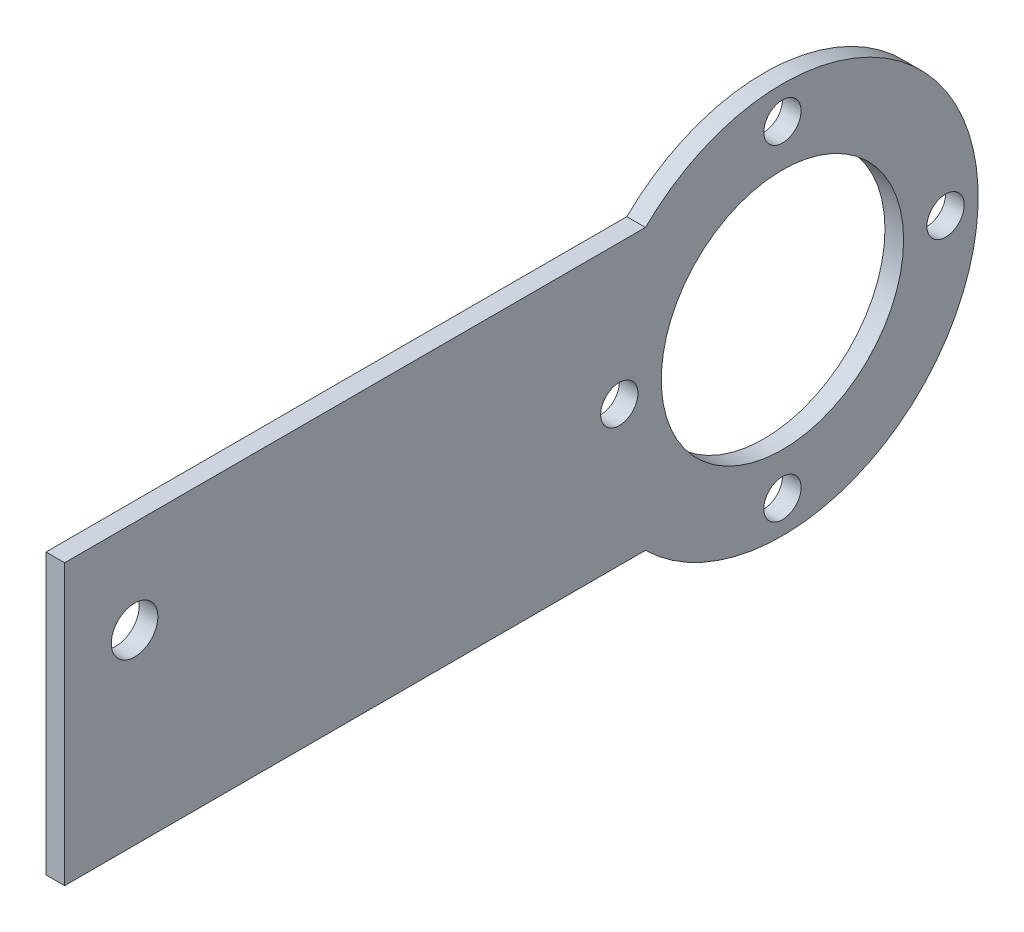
from build123d import *

# Parameters (mm, degrees)
EXTRUDE_1_DEPTH     = 2
CUT_EXTRUDE_START   = -3
SKETCH_2_R          = 2
SKETCH_2_R_2        = 13
CUT_EXTRUDE_1_DEPTH = 3
CUT_EXTRUDE_START_2 = -10
CUT_EXTRUDE_2_DEPTH = 10
SKETCH_3_R          = 2.5
CUT_EXTRUDE_4_DEPTH = 10


with BuildPart() as part:
    # 草图1 → 凸台-拉伸1 (new body)
    with BuildSketch(Plane(origin=(0, 0, 0), x_dir=(0, 0, -1), z_dir=(1, 0, 0))):
        with BuildLine():
            Line((-105.367573178, 55.412145146), (-28.367573178, 55.412145146))
            ThreePointArc((-28.367573178, 55.412145146), (-7.367573178, 34.412145146), (-28.367573178, 13.412145146))
            Line((-28.367573178, 13.412145146), (-105.367573178, 13.412145146))
            Line((-105.367573178, 13.412145146), (-105.367573178, 55.412145146))
        make_face()
    extrude(amount=EXTRUDE_1_DEPTH)

    # 草图2 → 切除-拉伸1 (cut)
    with BuildSketch(Plane(origin=(2, 0, 0), x_dir=(0, 0, -1), z_dir=(1, 0, 0)).offset(CUT_EXTRUDE_START)):
        with BuildLine():
            Line((-43.064511635, 19.412145146), (-105.367573178, 19.412145146))
            Line((-105.367573178, 19.412145146), (-105.367573178, 13.412145146))
            Line((-105.367573178, 13.412145146), (-28.367573178, 13.412145146))
            ThreePointArc((-28.367573178, 13.412145146), (-36.304827111, 14.96992305), (-43.064511635, 19.412145146))
        make_face()
        with Locations((-28.367573178, 51.912145146)):
            Circle(SKETCH_2_R)
        with Locations((-28.367573178, 16.912145146)):
            Circle(SKETCH_2_R)
        with Locations((-45.867573178, 34.412145146)):
            Circle(SKETCH_2_R)
        with Locations((-10.867573178, 34.412145146)):
            Circle(SKETCH_2_R)
        with Locations((-28.367573178, 34.412145146)):
            Circle(SKETCH_2_R_2)
    extrude(amount=CUT_EXTRUDE_1_DEPTH, mode=Mode.SUBTRACT)

    # 草图2<3> → 切除-拉伸2 (cut)
    with BuildSketch(Plane(origin=(2, 0, 0), x_dir=(0, 0, -1), z_dir=(1, 0, 0)).offset(CUT_EXTRUDE_START_2)):
        with BuildLine():
            Line((-105.367573178, 55.412145146), (-105.367573178, 49.412145146))
            Line((-105.367573178, 49.412145146), (-43.064511635, 49.412145146))
            ThreePointArc((-43.064511635, 49.412145146), (-36.304827111, 53.854367241), (-28.367573178, 55.412145146))
            Line((-28.367573178, 55.412145146), (-105.367573178, 55.412145146))
        make_face()
    extrude(amount=CUT_EXTRUDE_2_DEPTH, mode=Mode.SUBTRACT)

    # 草图3 → 切除-拉伸4 (cut)
    with BuildSketch(Plane(origin=(2, 0, 0), x_dir=(0, 0, -1), z_dir=(1, 0, 0))):
        with Locations((-97.867573178, 39.412145146)):
            Circle(SKETCH_3_R)
    extrude(amount=-CUT_EXTRUDE_4_DEPTH, mode=Mode.SUBTRACT)


solid = part.part
